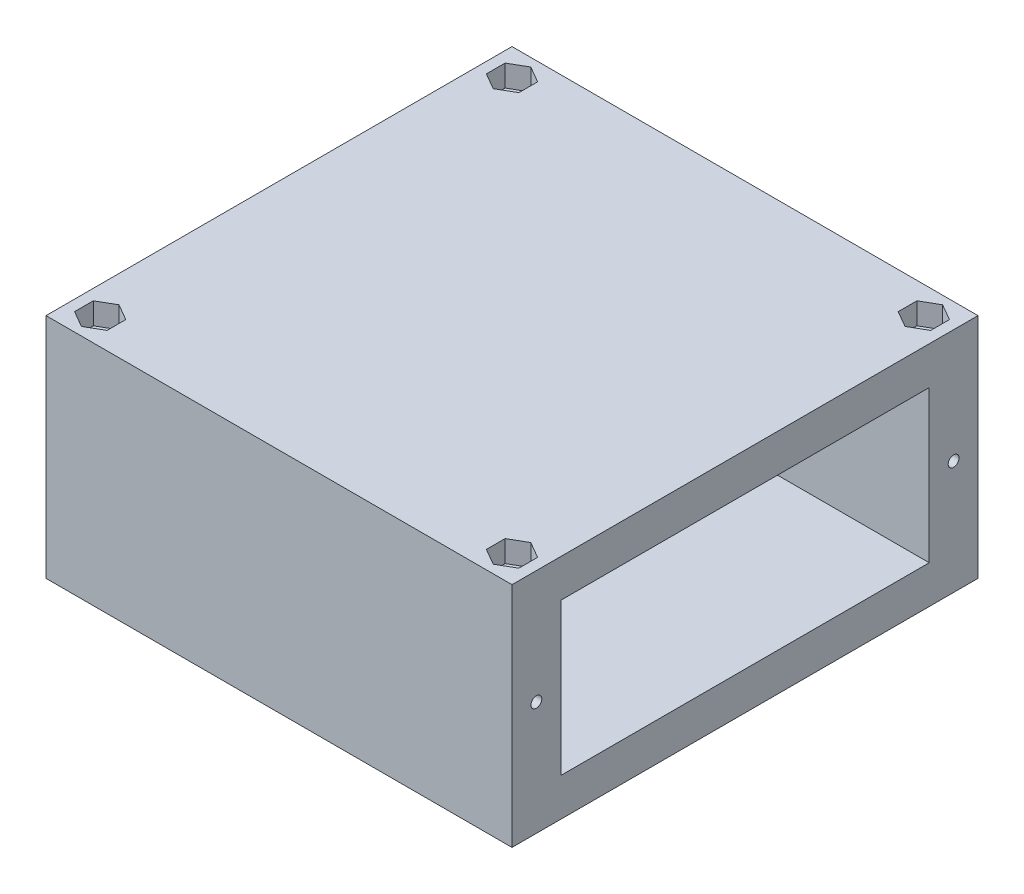
from build123d import *

# Parameters (mm, degrees)
ESBO_O1_W                = 86
ESBO_O1_H                = 86
RESSALTO_EXTRUS_O1_DEPTH = 21
ESBO_O2_W                = 68
ESBO_O2_H                = 28
CORTE_EXTRUS_O1_DEPTH    = 78
ESBO_O6_R                = 1.65
CORTE_EXTRUS_O3_DEPTH    = 9
CORTE_EXTRUS_O4_DEPTH    = 4
ESPELHAR2_COPY_1_DEPTH   = 4
CORTE_EXTRUS_O5_START    = -9
ESBO_O8_R                = 1.65
CORTE_EXTRUS_O5_DEPTH    = 9
ESPELHAR4_COPY_1_DEPTH   = 4
ESPELHAR4_COPY_2_DEPTH   = 4
ESPELHAR4_COPY_3_DEPTH   = 4
ESBO_O9_R                = 1
CORTE_EXTRUS_O6_DEPTH    = 6


with BuildPart() as part:
    # Esboço1 → Ressalto-extrusão1 (new, symmetric)
    with BuildSketch(Plane(origin=(0, 0, 0), x_dir=(1, 0, 0), z_dir=(0, 1, 0))):
        Rectangle(ESBO_O1_W, ESBO_O1_H)
    extrude(amount=RESSALTO_EXTRUS_O1_DEPTH, both=True)

    # Esboço2 → Corte-extrusão1 (cut)
    with BuildSketch(Plane(origin=(43, 0, 0), x_dir=(0, 0, -1), z_dir=(1, 0, 0))):
        Rectangle(ESBO_O2_W, ESBO_O2_H)
    extrude(amount=-CORTE_EXTRUS_O1_DEPTH, mode=Mode.SUBTRACT)

    # Esboço6 → Corte-extrusão3 (cut)
    with BuildSketch(Plane(origin=(0, 21, 0), x_dir=(1, 0, 0), z_dir=(0, 1, 0))):
        with Locations(Location((-38, -38, 0), (0, 0, 270))):
            Circle(ESBO_O6_R)
        with Locations(Location((-38, 38, 0), (0, 0, 270))):
            Circle(ESBO_O6_R)
        with Locations(Location((38, 38, 0), (0, 0, 270))):
            Circle(ESBO_O6_R)
        with Locations(Location((38, -38, 0), (0, 0, 270))):
            Circle(ESBO_O6_R)
    extrude(amount=-CORTE_EXTRUS_O3_DEPTH, mode=Mode.SUBTRACT)

    # Esboço7 → Corte-extrusão4 (cut)
    with BuildSketch(Plane(origin=(0, 21, 0), x_dir=(1, 0, 0), z_dir=(0, 1, 0))):
        Polygon((-38, -34.535898385), (-41, -36.267949192), (-41, -39.732050808), (-38, -41.464101615), (-35, -39.732050808), (-35, -36.267949192), align=None)
    corte_extrus_o4 = extrude(amount=-CORTE_EXTRUS_O4_DEPTH, mode=Mode.SUBTRACT)

    # Espelhar1: Corte-extrusão4 across plane
    add(corte_extrus_o4.mirror(Plane.XY), mode=Mode.SUBTRACT)

    # Espelhar2: Corte-extrusão4 across plane
    add(corte_extrus_o4.mirror(Plane(origin=(0, 0, 0), x_dir=(0, 0, 1), z_dir=(1, 0, 0))), mode=Mode.SUBTRACT)

    # Espelhar2 copy 1 sketch → Espelhar2 copy 1 (cut)
    with BuildSketch(Plane(origin=(0, 21, 0), x_dir=(-1, 0, 0), z_dir=(0, 1, 0))):
        Polygon((-38, -34.535898385), (-41, -36.267949192), (-41, -39.732050808), (-38, -41.464101615), (-35, -39.732050808), (-35, -36.267949192), align=None)
    extrude(amount=-ESPELHAR2_COPY_1_DEPTH, mode=Mode.SUBTRACT)

    # Esboço8 → Corte-extrusão5 (cut)
    with BuildSketch(Plane.XZ.offset(21).offset(CORTE_EXTRUS_O5_START)):
        with Locations(Location((38, 38, 0), (0, 0, 90))):
            Circle(ESBO_O8_R)
        with Locations(Location((38, -38, 0), (0, 0, 90))):
            Circle(ESBO_O8_R)
        with Locations(Location((-38, -38, 0), (0, 0, 90))):
            Circle(ESBO_O8_R)
        with Locations(Location((-38, 38, 0), (0, 0, 90))):
            Circle(ESBO_O8_R)
    extrude(amount=CORTE_EXTRUS_O5_DEPTH, mode=Mode.SUBTRACT)

    # Espelhar4: Corte-extrusão4 across plane
    add(corte_extrus_o4.mirror(Plane.ZX), mode=Mode.SUBTRACT)

    # Espelhar4 copy 1 sketch → Espelhar4 copy 1 (cut)
    with BuildSketch(Plane.XZ.offset(21)):
        Polygon((-38, -34.535898385), (-41, -36.267949192), (-41, -39.732050808), (-38, -41.464101615), (-35, -39.732050808), (-35, -36.267949192), align=None)
    extrude(amount=-ESPELHAR4_COPY_1_DEPTH, mode=Mode.SUBTRACT)

    # Espelhar4 copy 2 sketch → Espelhar4 copy 2 (cut)
    with BuildSketch(Plane(origin=(0, -21, 0), x_dir=(-1, 0, 0), z_dir=(0, -1, 0))):
        Polygon((-38, -34.535898385), (-41, -36.267949192), (-41, -39.732050808), (-38, -41.464101615), (-35, -39.732050808), (-35, -36.267949192), align=None)
    extrude(amount=-ESPELHAR4_COPY_2_DEPTH, mode=Mode.SUBTRACT)

    # Espelhar4 copy 3 sketch → Espelhar4 copy 3 (cut)
    with BuildSketch(Plane(origin=(0, -21, 0), x_dir=(-1, 0, 0), z_dir=(0, -1, 0))):
        Polygon((-38, 34.535898385), (-41, 36.267949192), (-41, 39.732050808), (-38, 41.464101615), (-35, 39.732050808), (-35, 36.267949192), align=None)
    extrude(amount=-ESPELHAR4_COPY_3_DEPTH, mode=Mode.SUBTRACT)

    # Esboço9 → Corte-extrusão6 (cut)
    with BuildSketch(Plane(origin=(43, 0, 0), x_dir=(0, 0, -1), z_dir=(1, 0, 0))):
        with Locations((-38.5, 0)):
            Circle(ESBO_O9_R)
        with Locations((38.5, 0)):
            Circle(ESBO_O9_R)
    extrude(amount=-CORTE_EXTRUS_O6_DEPTH, mode=Mode.SUBTRACT)


solid = part.part
